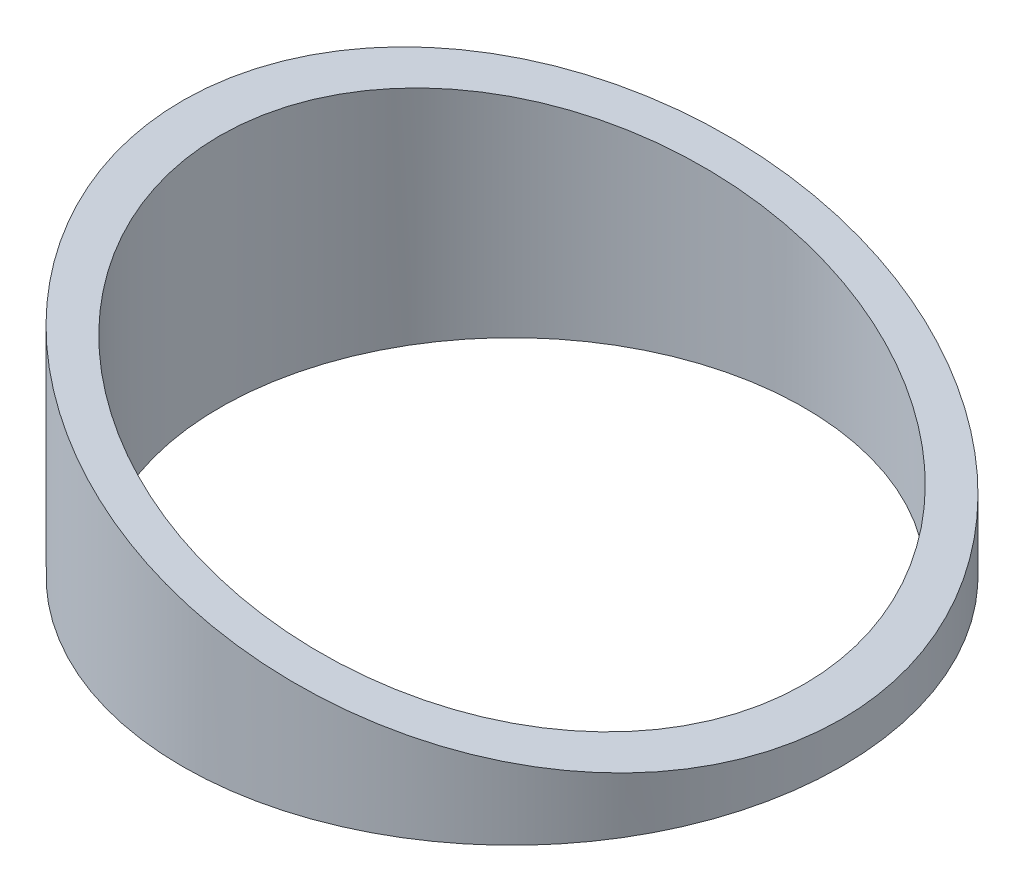
from build123d import *

# Parameters (mm, degrees)
SKETCH1_R               = 26.5
SKETCH1_R_2             = 23.5
BOSS_EXTRUDE1_DEPTH     = 20
CUT_EXTRUDE1_DEPTH      = 43.479406776
CUT_EXTRUDE1_DEPTH_BACK = 43.479406776


with BuildPart() as part:
    # Sketch1 → Boss-Extrude1 (new body)
    with BuildSketch(Plane(origin=(0, 0, 0), x_dir=(1, 0, 0), z_dir=(0, 1, 0))):
        with Locations(Location((0, 0, 0), (0, 0, 270))):
            Circle(SKETCH1_R)
        with Locations(Location((0, 0, 0), (0, 0, 270))):
            Circle(SKETCH1_R_2, mode=Mode.SUBTRACT)
    extrude(amount=BOSS_EXTRUDE1_DEPTH)

    # Sketch2 → Cut-Extrude1 (cut, two sides: drawn at the far end of the back side and taken through both)
    with BuildSketch(Plane.XY.offset(-CUT_EXTRUDE1_DEPTH_BACK)):
        Polygon((29.133638623, 2.471923918), (-28.960699765, 20.644101462), (-26.135561382, 26.70505569), (41.765015447, 26.171274273), align=None)
    extrude(amount=CUT_EXTRUDE1_DEPTH + CUT_EXTRUDE1_DEPTH_BACK, mode=Mode.SUBTRACT)


solid = part.part
